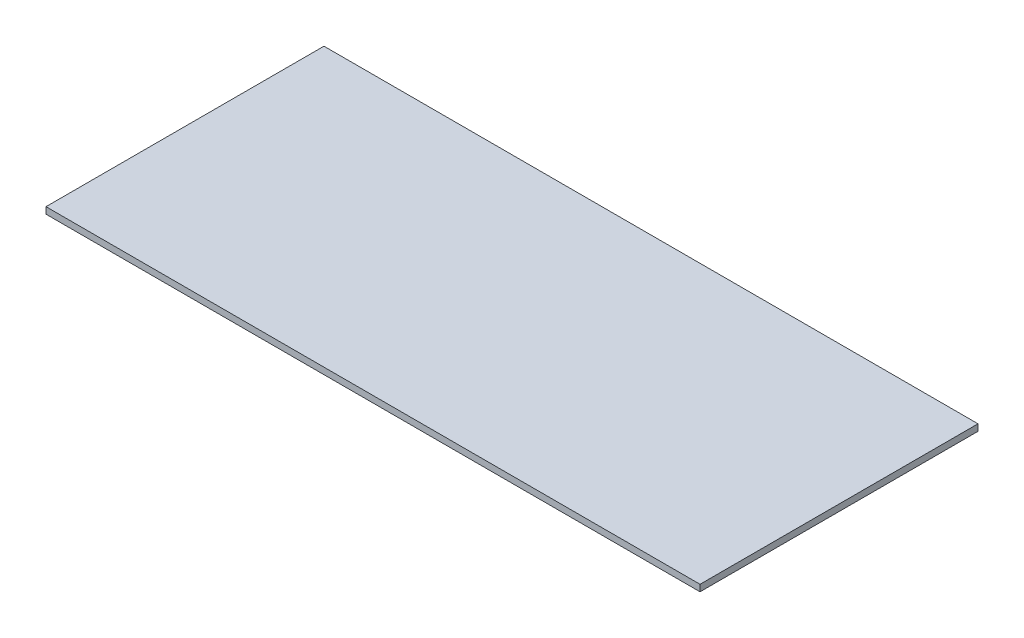
from build123d import *

# Parameters (mm, degrees)
SKETCH1_W           = 400
SKETCH1_H           = 170
BOSS_EXTRUDE1_DEPTH = 4


with BuildPart() as part:
    # Sketch1 → Boss-Extrude1 (new body)
    with BuildSketch(Plane(origin=(0, 19, 0), x_dir=(1, 0, 0), z_dir=(0, 1, 0))):
        with Locations((300, -345)):
            Rectangle(SKETCH1_W, SKETCH1_H)
    extrude(amount=BOSS_EXTRUDE1_DEPTH)


solid = part.part
